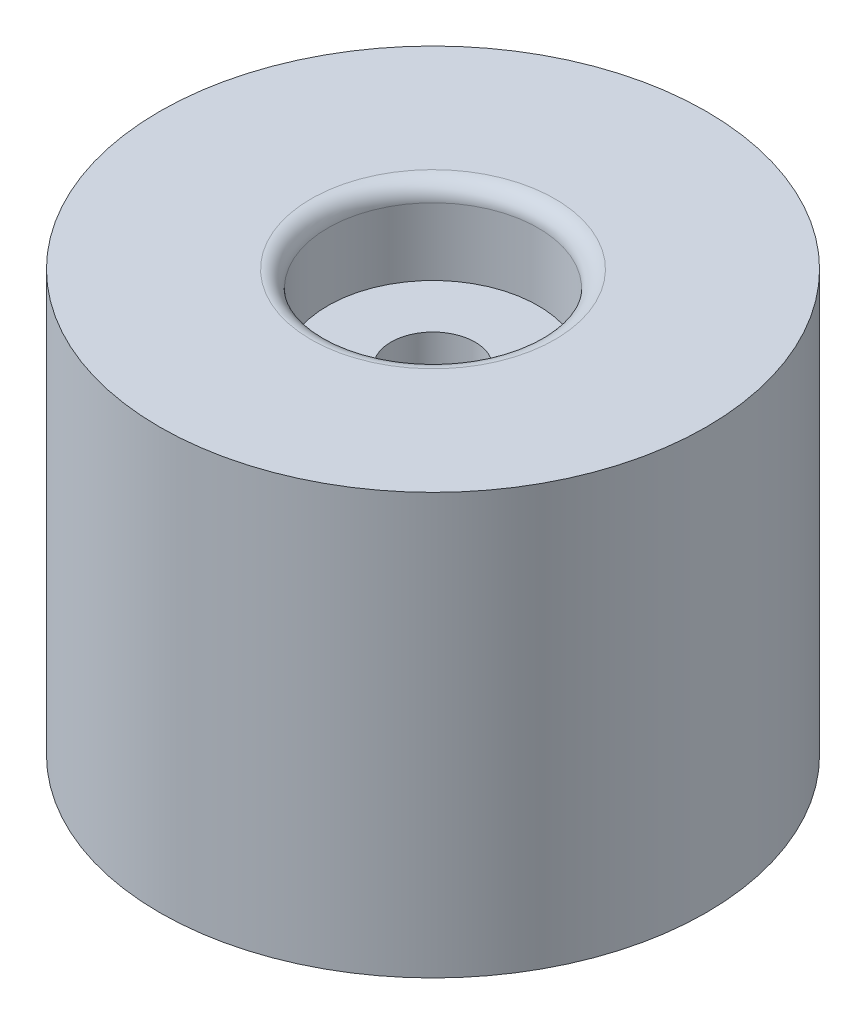
from build123d import *

# Parameters (mm, degrees)
SKETCH1_R           = 6.5
BOSS_EXTRUDE1_DEPTH = 6
SKETCH3_R           = 6.5
SKETCH3_R_2         = 1
BOSS_EXTRUDE2_DEPTH = 4
SKETCH4_R           = 2.5
CUT_EXTRUDE1_DEPTH  = 2
FILLET1_R           = 0.4


with BuildPart() as part:
    # Sketch1 → Boss-Extrude1 (new body)
    with BuildSketch(Plane(origin=(0, 0, 0), x_dir=(1, 0, 0), z_dir=(0, 1, 0))):
        with Locations(Location((0, 0, 0), (0, 0, 270))):
            Circle(SKETCH1_R)
        Polygon((5.05, -2.915618859), (5.05, 2.915618859), (0, 5.831237719), (-5.05, 2.915618859), (-5.05, -2.915618859), (0, -5.831237719), align=None, mode=Mode.SUBTRACT)
    extrude(amount=BOSS_EXTRUDE1_DEPTH)

    # Sketch3 → Boss-Extrude2 (add)
    with BuildSketch(Plane(origin=(0, 6, 0), x_dir=(1, 0, 0), z_dir=(0, 1, 0))):
        with Locations(Location((0, 0, 0), (0, 0, 270))):
            Circle(SKETCH3_R)
        with Locations(Location((0, 0, 0), (0, 0, 270))):
            Circle(SKETCH3_R_2, mode=Mode.SUBTRACT)
    extrude(amount=BOSS_EXTRUDE2_DEPTH)

    # Sketch4 → Cut-Extrude1 (cut)
    with BuildSketch(Plane(origin=(0, 10, 0), x_dir=(1, 0, 0), z_dir=(0, 1, 0))):
        with Locations(Location((0, 0, 0), (0, 0, 270))):
            Circle(SKETCH4_R)
    extrude(amount=-CUT_EXTRUDE1_DEPTH, mode=Mode.SUBTRACT)

    # Fillet1
    fillet1_edges = [part.edges().sort_by_distance(p)[0] for p in [
        (0, 10, -2.5),
    ]]
    fillet(fillet1_edges, radius=FILLET1_R)


solid = part.part
